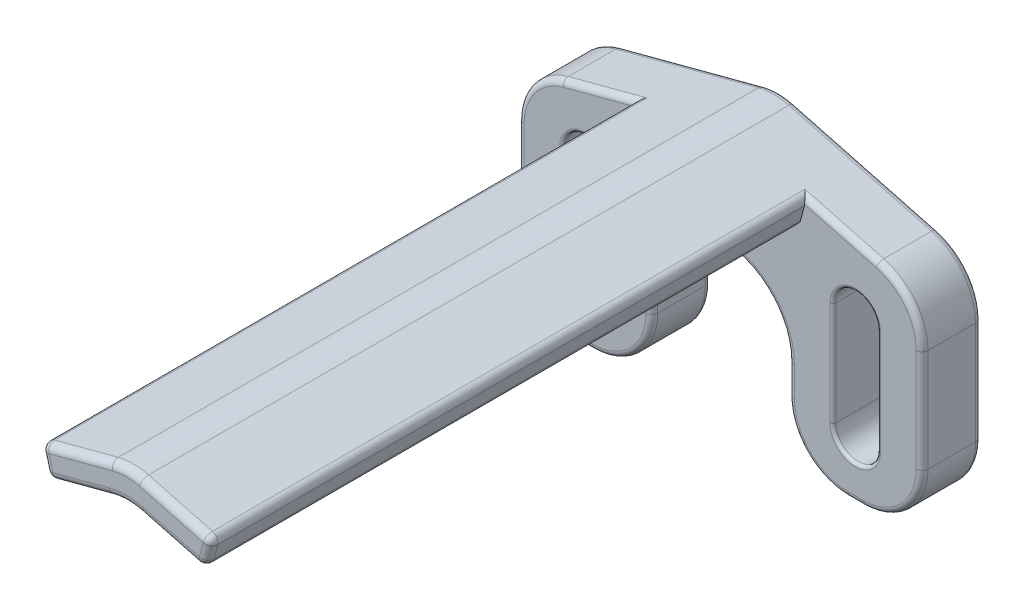
from build123d import *

# Parameters (mm, degrees)
BOSS_EXTRUDE1_DEPTH     = 5.08
FILLET1_R               = 5.08
CUT_EXTRUDE1_DEPTH      = 23.032212417276664
CUT_EXTRUDE1_DEPTH_BACK = 23.032212417276664
BOSS_EXTRUDE2_DEPTH     = 50.8
FILLET2_R               = 5.08
FILLET3_R               = 0.635
FILLET4_R               = 0.635
FILLET5_R               = 0.508
FILLET6_R               = 0.254


with BuildPart() as part:
    # Sketch1 → Boss-Extrude1 (new body)
    with BuildSketch(Plane.XY):
        with BuildLine():
            Line((-17.271999999999995, -5.080000000000001), (-17.271999999999995, -12.699999999999998))
            Line((-17.271999999999995, -12.699999999999998), (-5.8420000000000005, -12.699999999999998))
            Line((-5.8420000000000005, -12.699999999999998), (-5.842, -5.080000000000001))
            ThreePointArc((-5.842, -5.080000000000001), (3.83e-15, 0.761999999999996), (5.8420000000000005, -5.080000000000001))
            Line((5.8420000000000005, -5.080000000000001), (5.8420000000000005, -12.699999999999998))
            Line((5.8420000000000005, -12.699999999999998), (17.271999999999995, -12.699999999999998))
            Line((17.271999999999995, -12.699999999999998), (17.272000000000002, -5.080000000000001))
            Line((17.272000000000002, -5.080000000000001), (17.272000000000002, 5.079999999999999))
            Line((17.272000000000002, 5.079999999999999), (0, 9.651999999999997))
            Line((0, 9.651999999999997), (-17.271999999999995, 5.079999999999999))
            Line((-17.271999999999995, 5.079999999999999), (-17.271999999999995, -5.080000000000001))
        make_face()
    extrude(amount=BOSS_EXTRUDE1_DEPTH)

    # Fillet1
    fillet1_edges = [part.edges().sort_by_distance(p)[0] for p in [
        (17.271999999999995, -12.699999999999998, 2.54),
        (5.8420000000000005, -12.699999999999998, 2.54),
        (-5.8420000000000005, -12.699999999999998, 2.54),
        (-17.271999999999995, -12.699999999999998, 2.54),
    ]]
    fillet(fillet1_edges, radius=FILLET1_R)

    # Sketch2 → Cut-Extrude1 (cut, two sides: drawn at the far end of the back side and taken through both)
    with BuildSketch(Plane.XY.offset(5.08).offset(-CUT_EXTRUDE1_DEPTH_BACK)):
        with BuildLine():
            Line((-9.651999999999997, 1.0159999999999987), (-9.651999999999997, -7.873999999999999))
            ThreePointArc((-9.651999999999997, -7.873999999999999), (-11.557, -9.779), (-13.462000000000002, -7.873999999999999))
            Line((-13.462000000000002, -7.873999999999999), (-13.462000000000002, 1.0159999999999987))
            ThreePointArc((-13.462000000000002, 1.0159999999999987), (-11.557, 2.9210000000000016), (-9.651999999999997, 1.0159999999999987))
        make_face()
        with BuildLine():
            Line((13.462000000000002, 1.0160000000000007), (13.462000000000003, -7.873999999999999))
            ThreePointArc((13.462000000000003, -7.873999999999999), (11.557, -9.779000000000002), (9.651999999999997, -7.873999999999999))
            Line((9.651999999999997, -7.873999999999999), (9.651999999999997, 1.0160000000000002))
            ThreePointArc((9.651999999999997, 1.0160000000000002), (11.557, 2.9210000000000016), (13.462000000000002, 1.0160000000000007))
        make_face()
    extrude(amount=CUT_EXTRUDE1_DEPTH + CUT_EXTRUDE1_DEPTH_BACK, mode=Mode.SUBTRACT)

    # Sketch3 → Boss-Extrude2 (add)
    with BuildSketch(Plane.XY.offset(5.08)):
        Polygon((-6.716326733101362, 5.2466674116216865), (8.7e-16, 7.02451860567793), (6.716326733101362, 5.246667411621685), (7.36629383630472, 7.702098690389925), (0, 9.651999999999997), (-7.36629383630472, 7.702098690389927), align=None)
    extrude(amount=BOSS_EXTRUDE2_DEPTH)

    # Fillet2
    fillet2_edges = [part.edges().sort_by_distance(p)[0] for p in [
        (8.7e-16, 7.02451860567793, 30.479999999999997),
        (-17.271999999999995, 5.079999999999999, 2.54),
        (0, 9.651999999999997, 27.939999999999998),
        (17.272000000000002, 5.079999999999999, 2.54),
    ]]
    fillet(fillet2_edges, radius=FILLET2_R)

    # Fillet3
    fillet3_edges = [part.edges().sort_by_distance(p)[0] for p in [
        (-7.36629383630472, 7.702098690389927, 30.479999999999997),
        (-6.716326733101362, 5.2466674116216865, 30.479999999999997),
        (6.716326733101362, 5.246667411621685, 30.479999999999997),
        (7.36629383630472, 7.702098690389925, 30.479999999999997),
    ]]
    fillet(fillet3_edges, radius=FILLET3_R)

    # Fillet4
    fillet4_edges = [part.edges().sort_by_distance(p)[0] for p in [
        (4.026185111509681, 8.586245117541553, 55.879999999999995),
        (-4.026185111509695, 8.58624511754155, 55.879999999999995),
        (3.701201559908012, 6.044788780996396, 55.879999999999995),
        (-1.089e-14, 9.47703721135586, 55.879999999999995),
        (5.92e-15, 6.8495558170337905, 55.879999999999995),
        (7.041310284703042, 6.474383051005805, 55.879999999999995),
        (-7.041310284703041, 6.4743830510058045, 55.879999999999995),
        (-3.7012015599080064, 6.044788780996399, 55.879999999999995),
        (-6.584124679642968, 5.474054943570123, 55.879999999999995),
        (6.5841246796429695, 5.474054943570121, 55.879999999999995),
        (-7.138906304356284, 7.569896636931531, 55.879999999999995),
        (7.138906304356284, 7.569896636931532, 55.879999999999995),
    ]]
    fillet(fillet4_edges, radius=FILLET4_R)

    # Fillet5
    fillet5_edges = [part.edges().sort_by_distance(p)[0] for p in [
        (7.395934206406714, 7.69425271006881, 0),
        (5.8420000000000005, -6.35, 0),
        (-17.271999999999995, -3.2251284531456017, 0),
        (-7.39593420640672, 7.694252710068807, 0),
        (-1.089e-14, 9.47703721135586, 0),
        (-16.21754752602339, 4.268350380172661, 0),
        (-8.8e-16, 0.761999999999996, 0),
        (16.217547526023402, 4.268350380172659, 0),
        (-16.21754752602339, 4.268350380172661, 5.08),
        (16.217547526023402, 4.268350380172659, 5.08),
        (17.272, -3.2251284531456026, 0),
        (17.272, -3.2251284531456053, 5.08),
        (11.556999999999999, -12.699999999999998, 0),
        (-5.842, -6.35, 0),
        (-11.556999999999999, -12.699999999999998, 0),
        (-15.784102448427658, -11.212102448427661, 0),
        (-7.329897551572337, -11.212102448427657, 0),
        (-8.8e-16, 0.761999999999996, 5.08),
        (7.329897551572339, -11.212102448427661, 0),
        (15.784102448427655, -11.212102448427661, 0),
        (11.556999999999999, -12.699999999999998, 5.08),
        (-17.271999999999995, -3.2251284531456026, 5.08),
        (-11.556999999999999, -12.699999999999998, 5.08),
        (-5.842, -6.35, 5.08),
        (5.8420000000000005, -6.35, 5.08),
        (-15.784102448427658, -11.212102448427661, 5.08),
        (-7.329897551572337, -11.212102448427657, 5.08),
        (7.329897551572339, -11.212102448427661, 5.08),
        (15.784102448427655, -11.212102448427661, 5.08),
        (10.122185111509694, 6.972598058718023, 5.08),
        (-10.122185111509687, 6.972598058718021, 5.08),
    ]]
    fillet(fillet5_edges, radius=FILLET5_R)

    # Fillet6
    fillet6_edges = [part.edges().sort_by_distance(p)[0] for p in [
        (-11.556999999999999, 2.921000000000001, 0),
        (-9.651999999999997, -3.4290000000000003, 0),
        (-11.556999999999999, -9.779, 0),
        (-13.462000000000002, -3.4290000000000003, 0),
        (-11.556999999999999, 2.921000000000001, 5.08),
        (-13.462000000000002, -3.4290000000000003, 5.08),
        (-11.556999999999999, -9.779, 5.08),
        (-9.651999999999997, -3.4290000000000003, 5.08),
        (11.556999999999999, 2.921000000000001, 0),
        (13.462000000000003, -3.428999999999999, 0),
        (11.557, -9.779, 0),
        (9.651999999999997, -3.4289999999999994, 0),
        (11.556999999999999, 2.921000000000001, 5.08),
        (9.651999999999997, -3.4289999999999994, 5.08),
        (11.557, -9.779, 5.08),
        (13.462000000000003, -3.428999999999999, 5.08),
    ]]
    fillet(fillet6_edges, radius=FILLET6_R)


solid = part.part
